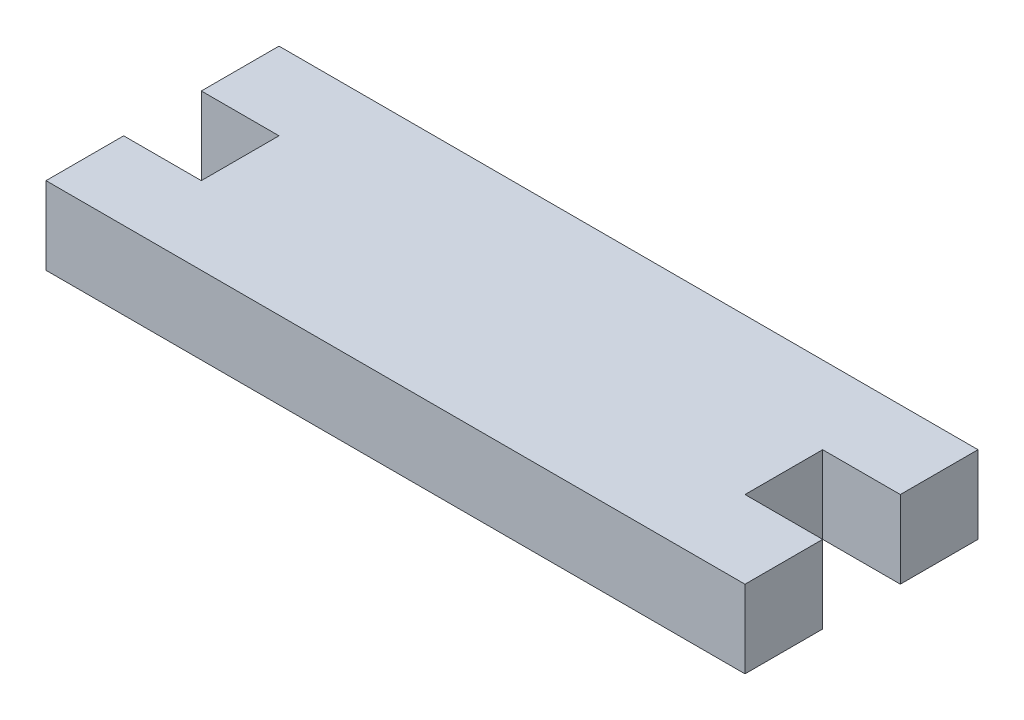
from build123d import *

# Parameters (mm, degrees)
BOSS_EXTRUDE1_DEPTH = 6.35


with BuildPart() as part:
    # Sketch1 → Boss-Extrude1 (new body)
    with BuildSketch(Plane(origin=(0, 0, 0), x_dir=(1, 0, 0), z_dir=(0, 1, 0))):
        Polygon((-28.575, -9.525), (-28.575, -3.175), (-22.225, -3.175), (-22.225, 3.175), (-28.575, 3.175), (-28.575, 9.525), (28.575, 9.525), (28.575, 3.175), (22.225, 3.175), (22.225, -3.175), (28.575, -3.175), (28.575, -9.525), align=None)
    extrude(amount=BOSS_EXTRUDE1_DEPTH)


solid = part.part
